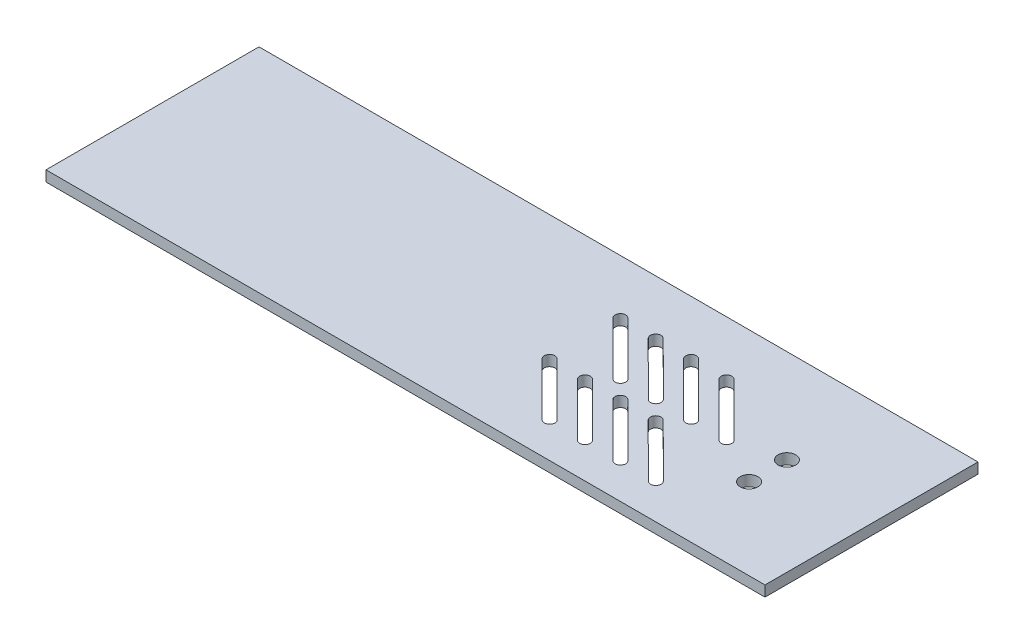
from build123d import *

# Parameters (mm, degrees)
SKETCH1_W           = 203.2
SKETCH1_H           = 60.2
BOSS_EXTRUDE1_DEPTH = 3
SKETCH5_R           = 2.5
CUT_EXTRUDE1_DEPTH  = 3
SKETCH7_R           = 2.5
CUT_EXTRUDE2_DEPTH  = 3
CUT_EXTRUDE3_DEPTH  = 3


with BuildPart() as part:
    # Sketch1 → Boss-Extrude1 (new body)
    with BuildSketch(Plane(origin=(0, 0, 0), x_dir=(1, 0, 0), z_dir=(0, 1, 0))):
        Rectangle(SKETCH1_W, SKETCH1_H)
    extrude(amount=BOSS_EXTRUDE1_DEPTH)

    # Sketch5 → Cut-Extrude1 (cut)
    with BuildSketch(Plane(origin=(0, 3, 0), x_dir=(1, 0, 0), z_dir=(0, 1, 0))):
        with Locations(Location((74.1, 3.6, 0), (0, 0, 270))):
            Circle(SKETCH5_R)
    extrude(amount=-CUT_EXTRUDE1_DEPTH, mode=Mode.SUBTRACT)

    # Sketch7 → Cut-Extrude2 (cut)
    with BuildSketch(Plane(origin=(0, 3, 0), x_dir=(1, 0, 0), z_dir=(0, 1, 0))):
        with Locations(Location((74.1, -7.1, 0), (0, 0, 270))):
            Circle(SKETCH7_R)
    extrude(amount=-CUT_EXTRUDE2_DEPTH, mode=Mode.SUBTRACT)

    # Sketch8 → Cut-Extrude3 (cut)
    with BuildSketch(Plane(origin=(0, 3, 0), x_dir=(1, 0, 0), z_dir=(0, 1, 0))):
        with BuildLine():
            Line((46.873111379, 15.864980996), (61.83445164, 0.932505799))
            ThreePointArc((61.83445164, 0.932505799), (61.836499957, -1.188813555), (59.715180603, -1.190861873))
            Line((59.715180603, -1.190861873), (44.753840342, 13.741613324))
            ThreePointArc((44.753840342, 13.741613324), (44.751792025, 15.862932678), (46.873111379, 15.864980996))
        make_face()
        with BuildLine():
            Line((36.873111379, 15.864980996), (51.83445164, 0.932505799))
            ThreePointArc((51.83445164, 0.932505799), (51.836499957, -1.188813555), (49.715180603, -1.190861873))
            Line((49.715180603, -1.190861873), (34.753840342, 13.741613324))
            ThreePointArc((34.753840342, 13.741613324), (34.751792025, 15.862932678), (36.873111379, 15.864980996))
        make_face()
        with BuildLine():
            Line((26.873111379, 15.864980996), (41.83445164, 0.932505799))
            ThreePointArc((41.83445164, 0.932505799), (41.836499957, -1.188813555), (39.715180603, -1.190861873))
            Line((39.715180603, -1.190861873), (24.753840342, 13.741613324))
            ThreePointArc((24.753840342, 13.741613324), (24.751792025, 15.862932678), (26.873111379, 15.864980996))
        make_face()
        with BuildLine():
            Line((16.873111379, 15.864980996), (31.83445164, 0.932505799))
            ThreePointArc((31.83445164, 0.932505799), (31.836499957, -1.188813555), (29.715180603, -1.190861873))
            Line((29.715180603, -1.190861873), (14.753840342, 13.741613324))
            ThreePointArc((14.753840342, 13.741613324), (14.751792025, 15.862932678), (16.873111379, 15.864980996))
        make_face()
        with BuildLine():
            Line((36.873111379, -4.135019004), (51.83445164, -19.067494201))
            ThreePointArc((51.83445164, -19.067494201), (51.836499957, -21.188813555), (49.715180603, -21.190861873))
            Line((49.715180603, -21.190861873), (34.753840342, -6.258386676))
            ThreePointArc((34.753840342, -6.258386676), (34.751792025, -4.137067322), (36.873111379, -4.135019004))
        make_face()
        with BuildLine():
            Line((26.873111379, -4.135019004), (41.83445164, -19.067494201))
            ThreePointArc((41.83445164, -19.067494201), (41.836499957, -21.188813555), (39.715180603, -21.190861873))
            Line((39.715180603, -21.190861873), (24.753840342, -6.258386676))
            ThreePointArc((24.753840342, -6.258386676), (24.751792025, -4.137067322), (26.873111379, -4.135019004))
        make_face()
        with BuildLine():
            Line((16.873111379, -4.135019004), (31.83445164, -19.067494201))
            ThreePointArc((31.83445164, -19.067494201), (31.836499957, -21.188813555), (29.715180603, -21.190861873))
            Line((29.715180603, -21.190861873), (14.753840342, -6.258386676))
            ThreePointArc((14.753840342, -6.258386676), (14.751792025, -4.137067322), (16.873111379, -4.135019004))
        make_face()
        with BuildLine():
            Line((46.873111379, -4.135019004), (61.83445164, -19.067494201))
            ThreePointArc((61.83445164, -19.067494201), (61.836499957, -21.188813555), (59.715180603, -21.190861873))
            Line((59.715180603, -21.190861873), (44.753840342, -6.258386676))
            ThreePointArc((44.753840342, -6.258386676), (44.751792025, -4.137067322), (46.873111379, -4.135019004))
        make_face()
    extrude(amount=-CUT_EXTRUDE3_DEPTH, mode=Mode.SUBTRACT)


solid = part.part
